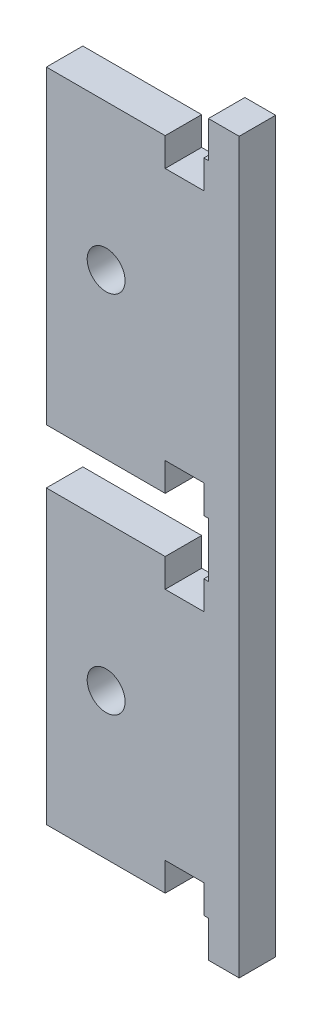
from build123d import *

# Parameters (mm, degrees)
SKETCH2_W               = 40.64
SKETCH2_H               = 127
BOSS_EXTRUDE1_DEPTH     = 6.35
M6_CLEARANCE_HOLE1_D    = 6.6
CUT_EXTRUDE1_DEPTH      = 134.495063954
CUT_EXTRUDE1_DEPTH_BACK = 134.495063954
SKETCH5_W               = 7.0505
SKETCH5_H               = 127
SKETCH6_W               = 25.85012
SKETCH6_H               = 3.175
SKETCH6_W_2             = 27.8745
CUT_EXTRUDE2_DEPTH      = 134.495063954
SKETCH7_W               = 6.35
SKETCH7_H               = 4.7625
CUT_EXTRUDE3_DEPTH      = 134.495063954


with BuildPart() as part:
    # Sketch2 → Boss-Extrude1 (new body)
    with BuildSketch(Plane.XY):
        with Locations((20.32, 63.5)):
            Rectangle(SKETCH2_W, SKETCH2_H)
    extrude(amount=BOSS_EXTRUDE1_DEPTH)

    # M6 Clearance Hole1 (through all)
    with Locations(Plane.XY.offset(6.35)):
        with Locations((17.4625, 31.75), (17.4625, 95.25)):
            Hole(M6_CLEARANCE_HOLE1_D / 2)

    # Sketch5 → Cut-Extrude1 (cut, two sides: drawn at the far end of the back side and taken through both)
    with BuildSketch(Plane.XY.offset(6.35).offset(-CUT_EXTRUDE1_DEPTH_BACK)):
        with Locations((3.52525, 63.5)):
            Rectangle(SKETCH5_W, SKETCH5_H)
    extrude(amount=CUT_EXTRUDE1_DEPTH + CUT_EXTRUDE1_DEPTH_BACK, mode=Mode.SUBTRACT)

    # Sketch6 → Cut-Extrude2 (cut, through all)
    with BuildSketch(Plane.XY.offset(6.35)):
        Polygon((7.0505, 123.825), (7.0505, 120.65), (35.28187, 120.65), (35.28187, 127), (32.90062, 127), (32.90062, 123.825), align=None)
        with Locations((19.97556, 125.4125)):
            Rectangle(SKETCH6_W, SKETCH6_H)
        Polygon((35.28187, 66.675), (7.0505, 66.675), (7.0505, 63.5), (32.90062, 63.5), (32.90062, 60.325), (7.0505, 60.325), (7.0505, 57.15), (35.28187, 57.15), align=None)
        with Locations((19.97556, 61.9125)):
            Rectangle(SKETCH6_W, SKETCH6_H)
        Polygon((35.28187, 0), (35.28187, 6.35), (7.0505, 6.35), (7.0505, 3.175), (34.925, 3.175), (34.925, 0), align=None)
        with Locations((20.98775, 1.5875)):
            Rectangle(SKETCH6_W_2, SKETCH6_H)
    extrude(amount=-CUT_EXTRUDE2_DEPTH, mode=Mode.SUBTRACT)

    # Sketch7 → Cut-Extrude3 (cut, through all)
    with BuildSketch(Plane.XY.offset(6.35)):
        with Locations((31.115, 8.73125)):
            Rectangle(SKETCH7_W, SKETCH7_H)
        Polygon((27.94, 11.1125), (34.29, 11.1125), (34.29, 6.35), (34.4805, 6.35), (34.4805, 11.303), (27.7495, 11.303), (27.7495, 6.35), (27.94, 6.35), align=None)
        Polygon((34.4805, 6.35), (34.29, 6.35), (27.94, 6.35), (27.7495, 6.35), (27.7495, 6.1595), (34.4805, 6.1595), align=None)
        with Locations((31.115, 54.76875)):
            Rectangle(SKETCH7_W, SKETCH7_H)
        Polygon((34.4805, 57.15), (34.29, 57.15), (34.29, 52.3875), (27.94, 52.3875), (27.94, 57.15), (27.7495, 57.15), (27.7495, 52.197), (34.4805, 52.197), align=None)
        Polygon((27.94, 57.15), (34.29, 57.15), (34.4805, 57.15), (34.4805, 57.3405), (27.7495, 57.3405), (27.7495, 57.15), align=None)
        Polygon((34.4805, 66.675), (34.29, 66.675), (27.94, 66.675), (27.7495, 66.675), (27.7495, 66.4845), (34.4805, 66.4845), align=None)
        with Locations((31.115, 69.05625)):
            Rectangle(SKETCH7_W, SKETCH7_H)
        Polygon((27.94, 71.4375), (34.29, 71.4375), (34.29, 66.675), (34.4805, 66.675), (34.4805, 71.628), (27.7495, 71.628), (27.7495, 66.675), (27.94, 66.675), align=None)
        with Locations((31.115, 118.26875)):
            Rectangle(SKETCH7_W, SKETCH7_H)
        Polygon((27.7495, 115.697), (34.4805, 115.697), (34.4805, 120.65), (34.29, 120.65), (34.29, 115.8875), (27.94, 115.8875), (27.94, 120.65), (27.7495, 120.65), align=None)
        Polygon((34.29, 120.65), (34.4805, 120.65), (34.4805, 120.8405), (27.7495, 120.8405), (27.7495, 120.65), (27.94, 120.65), align=None)
    extrude(amount=-CUT_EXTRUDE3_DEPTH, mode=Mode.SUBTRACT)


solid = part.part
